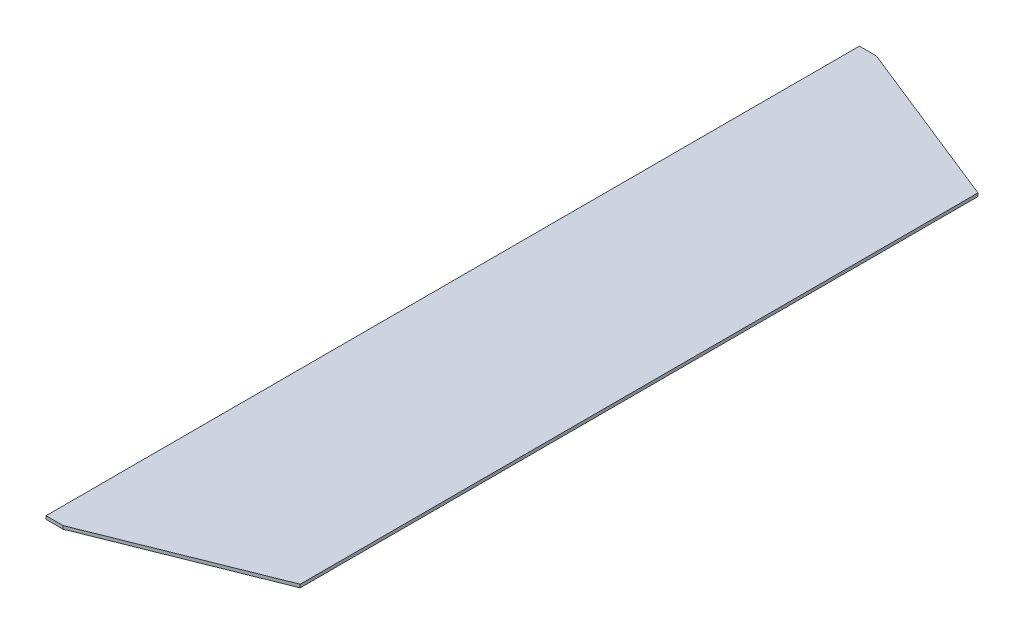
from build123d import *

# Parameters (mm, degrees)
BOSS_EXTRUDE1_DEPTH      = 152.4
BOSS_EXTRUDE1_DEPTH_BACK = 152.4
SKETCH3_W                = 69.85
SKETCH3_H                = 1.1938
SKETCH5_OUTSIDE_W        = 134.39
SKETCH5_OUTSIDE_H        = 369.34
CUT_EXTRUDE2_DEPTH       = 157.355175109


with BuildPart() as part:
    # Sketch3 → Boss-Extrude1 (new, two sides: drawn at the far end of the back side and taken through both)
    with BuildSketch(Plane.XY.offset(-BOSS_EXTRUDE1_DEPTH_BACK)):
        Rectangle(SKETCH3_W, SKETCH3_H)
    extrude(amount=BOSS_EXTRUDE1_DEPTH + BOSS_EXTRUDE1_DEPTH_BACK)

    # Sketch5 outside → Cut-Extrude2 (cut, through all)
    with BuildSketch(Plane.XZ.offset(0.5969)):
        Rectangle(SKETCH5_OUTSIDE_W, SKETCH5_OUTSIDE_H)
        Polygon((-28.575, 152.4), (34.925, 127), (34.925, -127), (-28.575, -152.4), (-34.925, -152.4), (-34.925, 152.4), align=None, mode=Mode.SUBTRACT)
    extrude(amount=-CUT_EXTRUDE2_DEPTH, mode=Mode.SUBTRACT)


solid = part.part
